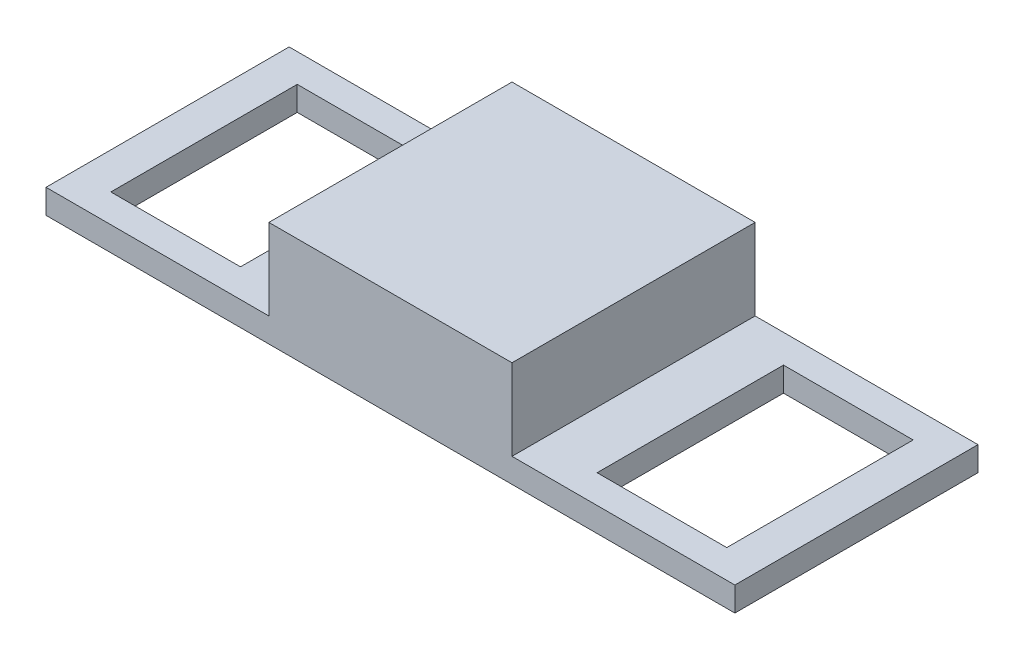
from build123d import *

# Parameters (mm, degrees)
CROQUIS1_W              = 85
CROQUIS1_H              = 30
CROQUIS1_W_2            = 16
CROQUIS1_H_2            = 23
SALIENTE_EXTRUIR1_DEPTH = 3
CROQUIS3_W              = 30
CROQUIS3_H              = 30
SALIENTE_EXTRUIR2_DEPTH = 10


with BuildPart() as part:
    # Croquis1 → Saliente-Extruir1 (new body)
    with BuildSketch(Plane(origin=(0, 0, 0), x_dir=(1, 0, 0), z_dir=(0, 1, 0))):
        Rectangle(CROQUIS1_W, CROQUIS1_H)
        with Locations((30, 0)):
            Rectangle(CROQUIS1_W_2, CROQUIS1_H_2, mode=Mode.SUBTRACT)
        with Locations((-30, 0)):
            Rectangle(CROQUIS1_W_2, CROQUIS1_H_2, mode=Mode.SUBTRACT)
    extrude(amount=SALIENTE_EXTRUIR1_DEPTH)

    # Croquis3 → Saliente-Extruir2 (add)
    with BuildSketch(Plane(origin=(0, 3, 0), x_dir=(1, 0, 0), z_dir=(0, 1, 0))):
        Rectangle(CROQUIS3_W, CROQUIS3_H)
    extrude(amount=SALIENTE_EXTRUIR2_DEPTH)


solid = part.part
